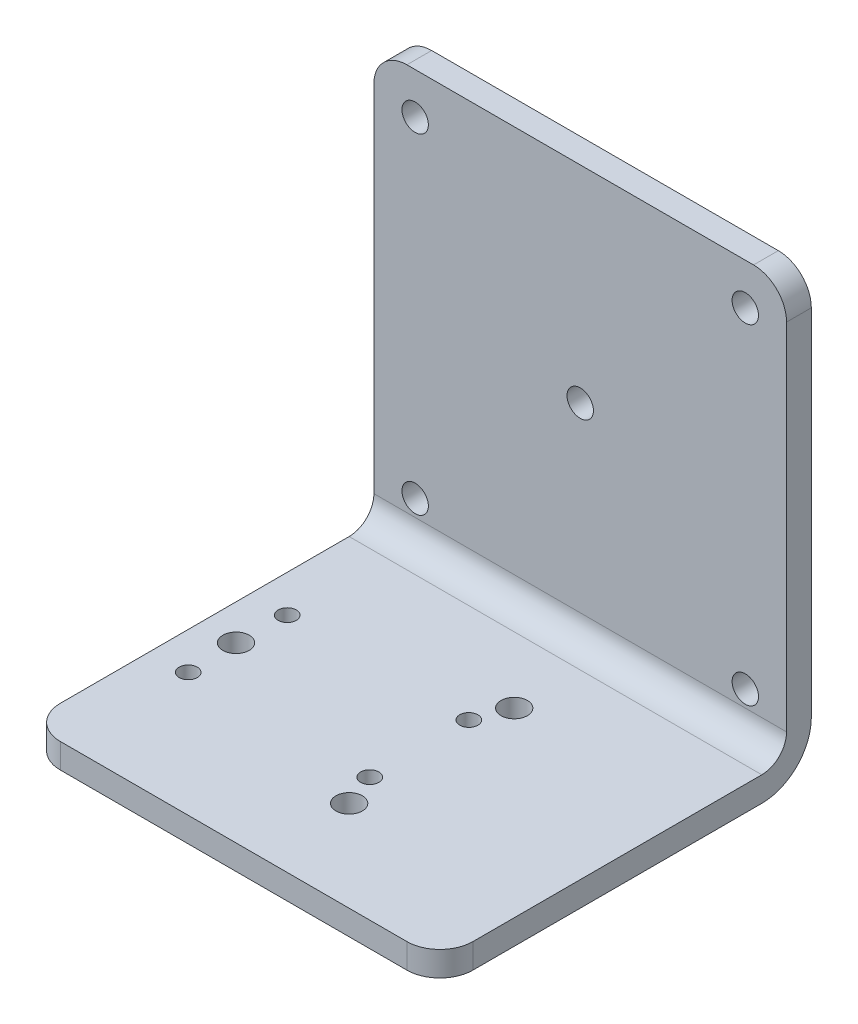
from build123d import *

# Parameters (mm, degrees)
SKETCH1_W           = 50
SKETCH1_H           = 45
BOSS_EXTRUDE1_DEPTH = 3
SKETCH2_W           = 50
SKETCH2_H           = 3
BOSS_EXTRUDE2_DEPTH = 50
SKETCH3_R           = 1.6
SKETCH3_R_2         = 1.1
CUT_EXTRUDE1_DEPTH  = 3
SKETCH4_R           = 1.6
CUT_EXTRUDE2_DEPTH  = 3
FILLET1_R           = 4
FILLET2_R           = 3
FILLET3_R           = 6


with BuildPart() as part:
    # Sketch1 → Boss-Extrude1 (new body)
    with BuildSketch(Plane(origin=(0, 0, 0), x_dir=(1, 0, 0), z_dir=(0, 1, 0))):
        Rectangle(SKETCH1_W, SKETCH1_H)
    extrude(amount=BOSS_EXTRUDE1_DEPTH)

    # Sketch2 → Boss-Extrude2 (add)
    with BuildSketch(Plane(origin=(0, 3, 0), x_dir=(1, 0, 0), z_dir=(0, 1, 0))):
        with Locations((0, 21)):
            Rectangle(SKETCH2_W, SKETCH2_H)
    extrude(amount=BOSS_EXTRUDE2_DEPTH)

    # Sketch3 → Cut-Extrude1 (cut)
    with BuildSketch(Plane(origin=(0, 3, 0), x_dir=(1, 0, 0), z_dir=(0, 1, 0))):
        with Locations(Location((3, 8.5, 0), (0, 0, 270))):
            Circle(SKETCH3_R)
        with Locations(Location((3, -11.5, 0), (0, 0, 90))):
            Circle(SKETCH3_R)
        with Locations(Location((-20.7, -1.5, 0), (0, 0, 270))):
            Circle(SKETCH3_R)
        with Locations(Location((1.5, 4.5, 0), (0, 0, 270))):
            Circle(SKETCH3_R_2)
        with Locations(Location((1.5, -7.5, 0), (0, 0, 90))):
            Circle(SKETCH3_R_2)
        with Locations(Location((-20.5, 4.5, 0), (0, 0, 270))):
            Circle(SKETCH3_R_2)
        with Locations(Location((-20.5, -7.5, 0), (0, 0, 90))):
            Circle(SKETCH3_R_2)
    extrude(amount=-CUT_EXTRUDE1_DEPTH, mode=Mode.SUBTRACT)

    # Sketch4 → Cut-Extrude2 (cut)
    with BuildSketch(Plane.XY.offset(-19.5)):
        with Locations((-20, 48)):
            Circle(SKETCH4_R)
        with Locations((20, 48)):
            Circle(SKETCH4_R)
        with Locations((20, 8)):
            Circle(SKETCH4_R)
        with Locations((-20, 8)):
            Circle(SKETCH4_R)
        with Locations((0, 28)):
            Circle(SKETCH4_R)
    extrude(amount=-CUT_EXTRUDE2_DEPTH, mode=Mode.SUBTRACT)

    # Fillet1
    fillet1_edges = [part.edges().sort_by_distance(p)[0] for p in [
        (-25, 53, -21),
        (25, 53, -21),
        (25, 1.5, 22.5),
        (-25, 1.5, 22.5),
    ]]
    fillet(fillet1_edges, radius=FILLET1_R)

    # Fillet2
    fillet2_edges = [part.edges().sort_by_distance(p)[0] for p in [
        (0, 3, -19.5),
    ]]
    fillet(fillet2_edges, radius=FILLET2_R)

    # Fillet3
    fillet3_edges = [part.edges().sort_by_distance(p)[0] for p in [
        (0, 0, -22.5),
    ]]
    fillet(fillet3_edges, radius=FILLET3_R)


solid = part.part
